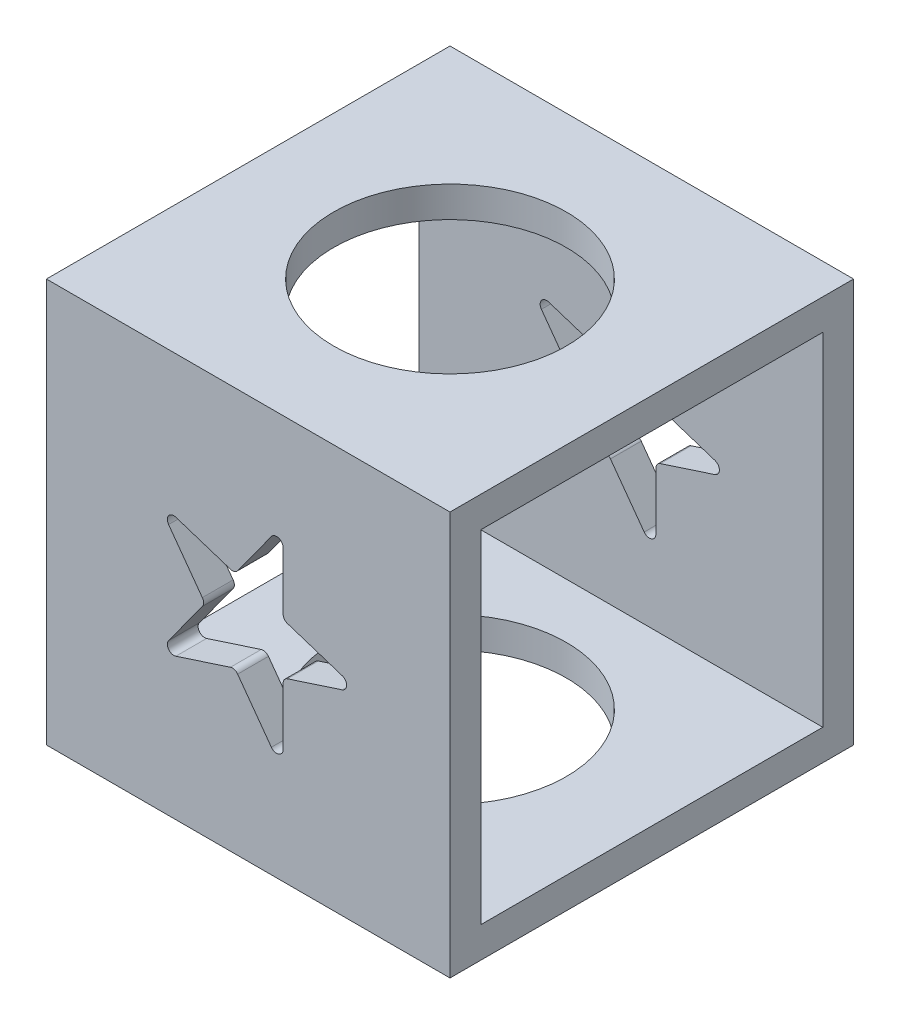
from build123d import *

# Parameters (mm, degrees)
SKETCH1_W           = 93.6625
SKETCH1_H           = 93.6625
BOSS_EXTRUDE1_DEPTH = 93.6625
SKETCH3_R           = 26.9875
CUT_EXTRUDE1_DEPTH  = 115.712666517
SKETCH4_W           = 79.375
SKETCH4_H           = 79.375
CUT_EXTRUDE2_DEPTH  = 141.49375
CUT_EXTRUDE3_DEPTH  = 141.49375
FILLET1_R           = 1.5
FILLET2_R           = 1.5


with BuildPart() as part:
    # Sketch1 → Boss-Extrude1 (new body)
    with BuildSketch(Plane(origin=(0, 0, 0), x_dir=(1, 0, 0), z_dir=(0, 1, 0))):
        Rectangle(SKETCH1_W, SKETCH1_H)
    extrude(amount=BOSS_EXTRUDE1_DEPTH)

    # Sketch3 → Cut-Extrude1 (cut, through all)
    with BuildSketch(Plane(origin=(0, 93.6625, 0), x_dir=(1, 0, 0), z_dir=(0, 1, 0))):
        with Locations(Location((0, 0, 0), (0, 0, 270))):
            Circle(SKETCH3_R)
    extrude(amount=-CUT_EXTRUDE1_DEPTH, mode=Mode.SUBTRACT)

    # Sketch4 → Cut-Extrude2 (cut, through all)
    with BuildSketch(Plane.ZY.offset(46.83125)):
        with Locations((0, 46.83125)):
            Rectangle(SKETCH4_W, SKETCH4_H)
    extrude(amount=-CUT_EXTRUDE2_DEPTH, mode=Mode.SUBTRACT)

    # Sketch5 → Cut-Extrude3 (cut, through all)
    with BuildSketch(Plane.XY.offset(46.83125)):
        Polygon((26.19375, 46.83125), (8.094313896, 52.712113281), (8.094313896, 71.742986624), (-3.091752793, 56.346686671), (-21.191188896, 62.227549952), (-10.005122207, 46.83125), (-21.191188896, 31.434950048), (-3.091752793, 37.315813329), (8.094313896, 21.919513376), (8.094313896, 40.950386719), align=None)
    extrude(amount=-CUT_EXTRUDE3_DEPTH, mode=Mode.SUBTRACT)

    # Fillet1
    fillet1_edges = [part.edges().sort_by_distance(p)[0] for p in [
        (26.19375, 46.83125, 43.259375),
        (8.094313896, 40.950386719, 43.259375),
        (8.094313896, 21.919513376, 43.259375),
        (-3.091752793, 37.315813329, 43.259375),
        (-21.191188896, 31.434950048, 43.259375),
        (-10.005122207, 46.83125, 43.259375),
        (-21.191188896, 62.227549952, 43.259375),
        (-3.091752793, 56.346686671, 43.259375),
        (8.094313896, 71.742986624, 43.259375),
        (8.094313896, 52.712113281, 43.259375),
    ]]
    fillet(fillet1_edges, radius=FILLET1_R)

    # Fillet2
    fillet2_edges = [part.edges().sort_by_distance(p)[0] for p in [
        (26.19375, 46.83125, -43.259375),
        (8.094313896, 40.950386719, -43.259375),
        (8.094313896, 21.919513376, -43.259375),
        (-3.091752793, 37.315813329, -43.259375),
        (-21.191188896, 31.434950048, -43.259375),
        (-10.005122207, 46.83125, -43.259375),
        (-21.191188896, 62.227549952, -43.259375),
        (-3.091752793, 56.346686671, -43.259375),
        (8.094313896, 71.742986624, -43.259375),
        (8.094313896, 52.712113281, -43.259375),
    ]]
    fillet(fillet2_edges, radius=FILLET2_R)


solid = part.part
